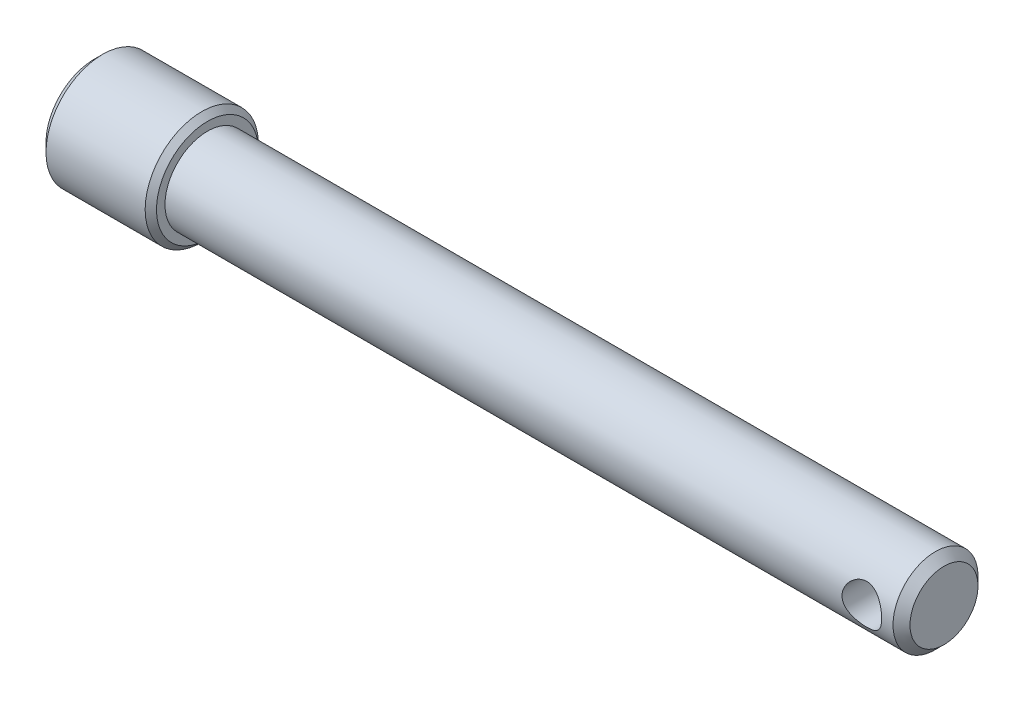
from build123d import *

# Parameters (mm, degrees)
CHANFREIN1_SIZE         = 3
CHANFREIN2_SIZE         = 3
ESQUISSE2_R             = 7
ENL_V_MAT_EXTRU_1_DEPTH = 45
CHANFREIN3_SIZE         = 2


with BuildPart() as part:
    # Esquisse1 → Révolution1 (revolve)
    with BuildSketch(Plane.XY, mode=Mode.PRIVATE) as r_volution1_sk:
        Polygon((0, 0), (0, 20), (40, 20), (40, 15), (300, 15), (300, 0), align=None)
    revolve(r_volution1_sk.sketch.rotate(Axis((0, 0, 0), (1, 0, 0)), 90), axis=Axis((0, 0, 0), (1, 0, 0)))

    # Chanfrein1
    chanfrein1_edges = [part.edges().sort_by_distance(p)[0] for p in [
        (0, 0, -20),
    ]]
    chamfer(chanfrein1_edges, length=CHANFREIN1_SIZE)

    # Chanfrein2
    chanfrein2_edges = [part.edges().sort_by_distance(p)[0] for p in [
        (300, 0, -15),
    ]]
    chamfer(chanfrein2_edges, length=CHANFREIN2_SIZE)

    # Esquisse2 → Enlèv. mat.-Extru.1 (cut, symmetric)
    with BuildSketch(Plane.XY):
        with Locations((286, 0)):
            Circle(ESQUISSE2_R)
    extrude(amount=ENL_V_MAT_EXTRU_1_DEPTH, both=True, mode=Mode.SUBTRACT)

    # Chanfrein3
    chanfrein3_edges = [part.edges().sort_by_distance(p)[0] for p in [
        (40, 0, -20),
    ]]
    chamfer(chanfrein3_edges, length=CHANFREIN3_SIZE)


solid = part.part
